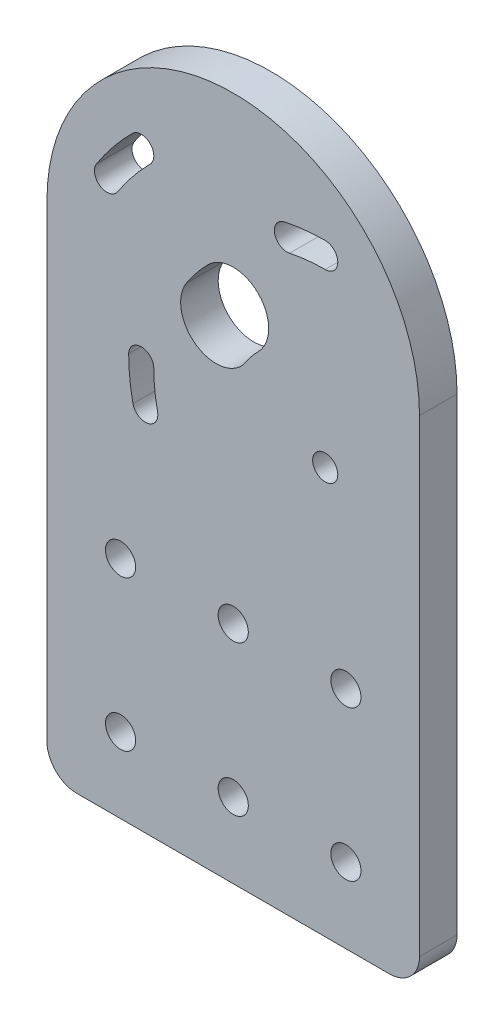
from build123d import *

# Parameters (mm, degrees)
SKETCH1_R           = 2.125
SKETCH1_R_2         = 2.5527
BOSS_EXTRUDE1_DEPTH = 6.35
FILLET1_R           = 5.08


with BuildPart() as part:
    # Sketch1 → Boss-Extrude1 (new body)
    with BuildSketch(Plane.XY):
        with BuildLine():
            Line((31.499999992, 0), (31.499999992, 84.3))
            ThreePointArc((31.499999992, 84.3), (0, 115.799999992), (-31.499999992, 84.3))
            Line((-31.499999992, 84.3), (-31.499999992, 0))
            Line((-31.499999992, 0), (31.499999992, 0))
        make_face()
        with Locations((15.556349186, 68.743650814)):
            Circle(SKETCH1_R, mode=Mode.SUBTRACT)
        with Locations((19.05, 12.7)):
            Circle(SKETCH1_R_2, mode=Mode.SUBTRACT)
        with Locations((0, 12.7)):
            Circle(SKETCH1_R_2, mode=Mode.SUBTRACT)
        with Locations((0, 38.1)):
            Circle(SKETCH1_R_2, mode=Mode.SUBTRACT)
        with Locations((19.05, 38.1)):
            Circle(SKETCH1_R_2, mode=Mode.SUBTRACT)
        with Locations((-19.05, 12.7)):
            Circle(SKETCH1_R_2, mode=Mode.SUBTRACT)
        with Locations((-19.05, 38.1)):
            Circle(SKETCH1_R_2, mode=Mode.SUBTRACT)
        with BuildLine():
            ThreePointArc((15.556349186, 101.981349186), (12.082063653, 101.799269597), (8.645843119, 101.255025731))
            ThreePointArc((8.645843119, 101.255025731), (7.00909181, 98.734649736), (9.529467805, 97.097898427))
            ThreePointArc((9.529467805, 97.097898427), (12.526309622, 97.572551541), (15.556349186, 97.731349186))
            ThreePointArc((15.556349186, 97.731349186), (17.681349186, 99.856349186), (15.556349186, 101.981349186))
        make_face(mode=Mode.SUBTRACT)
        with BuildLine():
            ThreePointArc((-17.681349186, 68.743650814), (-17.499269597, 65.26936528), (-16.955025731, 61.833144746))
            ThreePointArc((-16.955025731, 61.833144746), (-14.434649736, 60.196393438), (-12.797898427, 62.716769432))
            ThreePointArc((-12.797898427, 62.716769432), (-13.272551541, 65.713611249), (-13.431349186, 68.743650814))
            ThreePointArc((-13.431349186, 68.743650814), (-15.556349186, 70.868650814), (-17.681349186, 68.743650814))
        make_face(mode=Mode.SUBTRACT)
        with BuildLine():
            ThreePointArc((-17.058951096, 101.358951096), (-20.289508286, 97.771053851), (-23.12733076, 93.865126304))
            ThreePointArc((-23.12733076, 93.865126304), (-22.502513753, 90.925593398), (-19.562980847, 91.550410405))
            ThreePointArc((-19.562980847, 91.550410405), (-16.98663795, 95.096442189), (-14.053747276, 98.353747276))
            ThreePointArc((-14.053747276, 98.353747276), (-14.053747276, 101.358951096), (-17.058951096, 101.358951096))
        make_face(mode=Mode.SUBTRACT)
        with BuildLine():
            ThreePointArc((-4.242640687, 88.542640687), (-6.203737735, 86.364621763), (-7.926426716, 83.993543794))
            ThreePointArc((-7.926426716, 83.993543794), (-6.162237519, 75.693686177), (2.137620099, 77.457875374))
            ThreePointArc((2.137620099, 77.457875374), (3.122013803, 78.812777071), (4.242640687, 80.057359313))
            ThreePointArc((4.242640687, 80.057359313), (4.242640687, 88.542640687), (-4.242640687, 88.542640687))
        make_face(mode=Mode.SUBTRACT)
    extrude(amount=BOSS_EXTRUDE1_DEPTH)

    # Fillet1
    fillet1_edges = [part.edges().sort_by_distance(p)[0] for p in [
        (31.499999992, 0, 3.175),
        (-31.499999992, 0, 3.175),
    ]]
    fillet(fillet1_edges, radius=FILLET1_R)


solid = part.part
